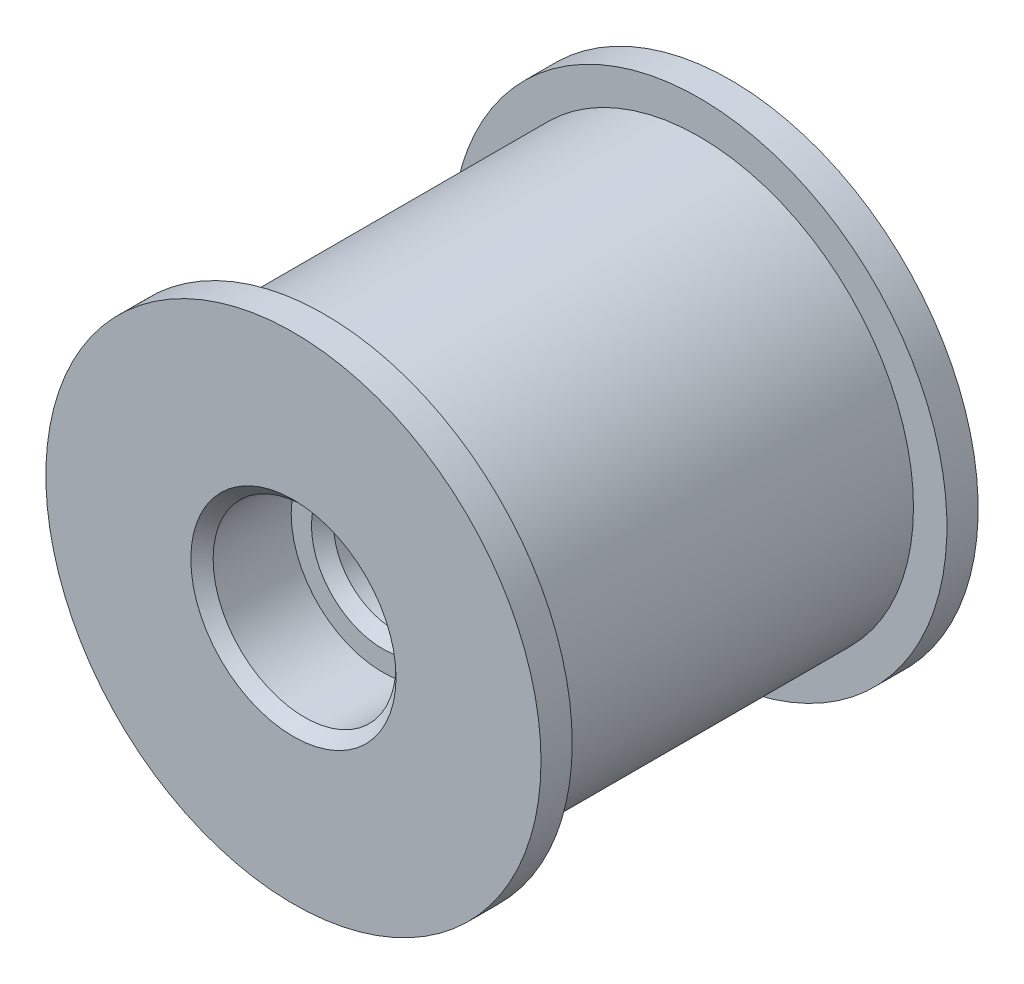
from build123d import *

# Parameters (mm, degrees)
AUFSATZ_LINEAR_AUSTRAGEN1_DEPTH      = 9.8
AUFSATZ_LINEAR_AUSTRAGEN1_DEPTH_BACK = 9.8
SKIZZE1_R                            = 9.6
SKIZZE2_R                            = 11.1
AUFSATZ_LINEAR_AUSTRAGEN2_DEPTH      = 1.4
AUFSATZ_LINEAR_START                 = -1.4
SKIZZE3_R                            = 11.1
AUFSATZ_LINEAR_AUSTRAGEN3_DEPTH      = 1.4
FASE1_SIZE                           = 0.5


with BuildPart() as part:
    # Skizze1 → Aufsatz-Linear austragen1 (new, two sides: drawn at the far end of the back side and taken through both)
    with BuildSketch(Plane.XY.offset(-AUFSATZ_LINEAR_AUSTRAGEN1_DEPTH_BACK)):
        Circle(SKIZZE1_R)
    extrude(amount=AUFSATZ_LINEAR_AUSTRAGEN1_DEPTH + AUFSATZ_LINEAR_AUSTRAGEN1_DEPTH_BACK)

    # Skizze2 → Aufsatz-Linear austragen2 (add)
    with BuildSketch(Plane.XY.offset(9.8)):
        Circle(SKIZZE2_R)
    extrude(amount=-AUFSATZ_LINEAR_AUSTRAGEN2_DEPTH)

    # Skizze3 → Aufsatz-Linear austragen3 (add)
    with BuildSketch(Plane(origin=(0, 0, -9.8), x_dir=(-1, 0, 0), z_dir=(0, 0, -1)).offset(AUFSATZ_LINEAR_START)):
        Circle(SKIZZE3_R)
    extrude(amount=AUFSATZ_LINEAR_AUSTRAGEN3_DEPTH)

    # Skizze8 → Schnitt-Rotation1 (revolve, cut)
    with BuildSketch(Plane(origin=(0, 0, 0), x_dir=(0, 0, -1), z_dir=(1, 0, 0))):
        Polygon((9.8, 0), (9.8, 8), (8.4, 8), (-2.2, 4), (-2.2, 2.691026714), (-5.8, 2.691026714), (-5.8, 4.1), (-9.8, 4.1), (-9.8, 0), align=None)
    revolve(axis=Axis((0, 0, -9.8), (0, 0, 1)), mode=Mode.SUBTRACT)

    # Fase1
    fase1_edges = [part.edges().sort_by_distance(p)[0] for p in [
        (0, -2.691026714, 5.8),
        (0, -2.691026714, 2.2),
        (0, -4.1, 9.8),
    ]]
    chamfer(fase1_edges, length=FASE1_SIZE)


solid = part.part
